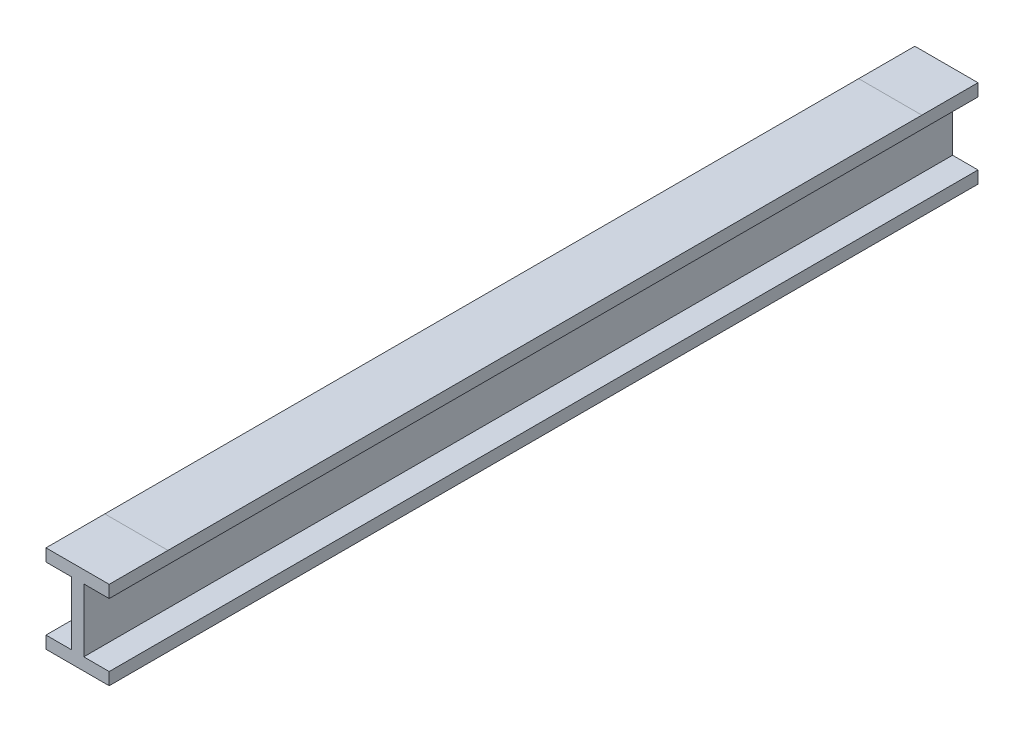
from build123d import *

# Parameters (mm, degrees)
DODANIE_WYCI_GNI_CIE1_DEPTH = 2200


with BuildPart() as part:
    # Szkic1 → Dodanie-wyciągnięcie1 (new body)
    with BuildSketch(Plane.XY):
        Polygon((0, 0), (160, 0), (160, 31.25), (95.625, 31.25), (95.625, 191.25), (160, 191.25), (160, 222.5), (0, 222.5), (0, 191.25), (64.375, 191.25), (64.375, 31.25), (0, 31.25), align=None)
    extrude(amount=DODANIE_WYCI_GNI_CIE1_DEPTH)


solid = part.part
